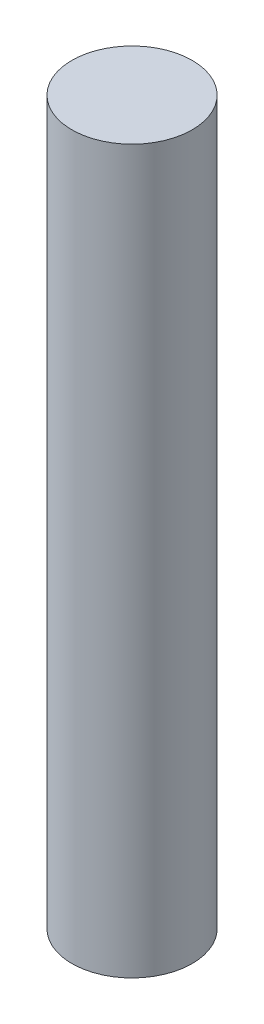
from build123d import *

# Parameters (mm, degrees)
SKETCH1_R           = 12.7
BOSS_EXTRUDE1_DEPTH = 152.4


with BuildPart() as part:
    # Sketch1 → Boss-Extrude1 (new body)
    with BuildSketch(Plane(origin=(0, 0, 0), x_dir=(1, 0, 0), z_dir=(0, 1, 0))):
        with Locations(Location((0, 0, 0), (0, 0, 90))):
            Circle(SKETCH1_R)
    extrude(amount=BOSS_EXTRUDE1_DEPTH)


solid = part.part
